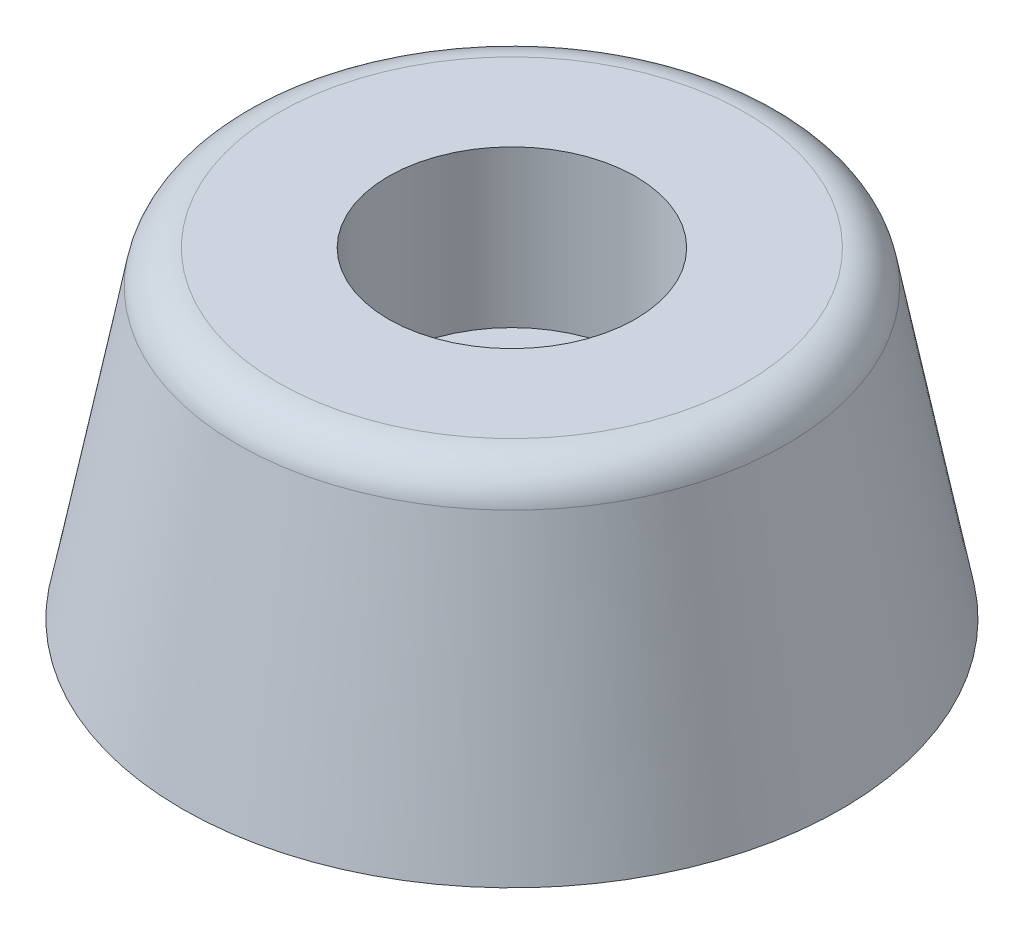
from build123d import *

# Parameters (mm, degrees)
ZAOBLIT1_R = 1


with BuildPart() as part:
    # Skica1 → Rotovat1 (revolve)
    with BuildSketch(Plane.XY, mode=Mode.PRIVATE) as rotovat1_sk:
        Polygon((-1.5, 0), (-8, 0), (-6.5, 7.8), (-3, 7.8), (-3, 4), (-1.5, 4), align=None)
    revolve(rotovat1_sk.sketch.rotate(Axis((0, 16.170731707, 0), (0, -1, 0)), 270), axis=Axis((0, 16.170731707, 0), (0, -1, 0)))

    # Zaoblit1
    zaoblit1_edges = [part.edges().sort_by_distance(p)[0] for p in [
        (0, 7.8, -6.5),
    ]]
    fillet(zaoblit1_edges, radius=ZAOBLIT1_R)


solid = part.part
